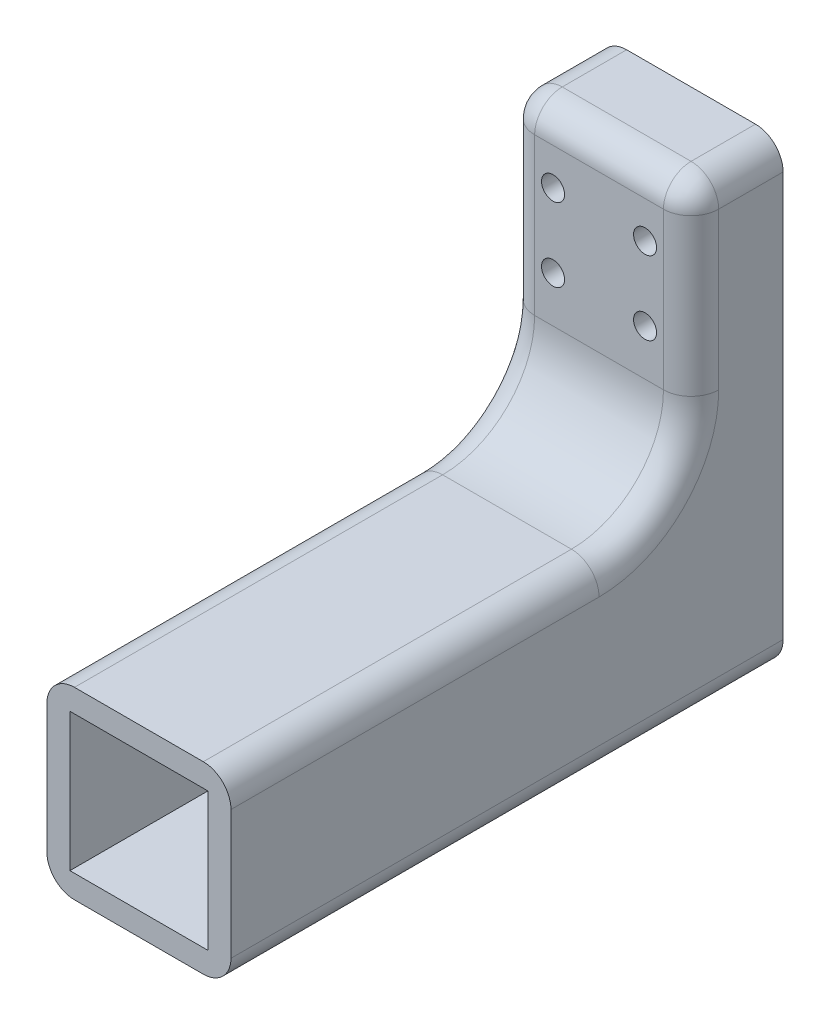
from build123d import *

# Parameters (mm, degrees)
SKETCH_4_W      = 20
SKETCH_4_H      = 20
SKETCH_4_W_2    = 15
SKETCH_4_H_2    = 15
EXTRUDE_3_DEPTH = 60
SKETCH_5_W      = 20
SKETCH_5_H      = 30
EXTRUDE_4_DEPTH = 10
M3X0_5_1_D      = 2.5
FILLET_1_R      = 10
FILLET_2_R      = 3
FILLET_3_R      = 3


with BuildPart() as part:
    # ｽｹｯﾁ4 → ﾎﾞｽ - 押し出し3 (new body)
    with BuildSketch(Plane.XY):
        Rectangle(SKETCH_4_W, SKETCH_4_H)
        Rectangle(SKETCH_4_W_2, SKETCH_4_H_2, mode=Mode.SUBTRACT)
    extrude(amount=EXTRUDE_3_DEPTH)

    # ｽｹｯﾁ5 → ﾎﾞｽ - 押し出し4 (add)
    with BuildSketch(Plane.XY):
        with Locations((0, 25)):
            Rectangle(SKETCH_5_W, SKETCH_5_H)
    extrude(amount=EXTRUDE_4_DEPTH)

    # M3x0.5 ねじ穴1 (through all)
    with Locations(Plane(origin=(0, 0, 0), x_dir=(-1, 0, 0), z_dir=(0, 0, -1))):
        with Locations((-5, 25), (-5, 33), (5, 33), (5, 25)):
            Hole(M3X0_5_1_D / 2)

    # ﾌｨﾚｯﾄ1
    fillet_1_edges = [part.edges().sort_by_distance(p)[0] for p in [
        (0, 10, 10),
    ]]
    fillet(fillet_1_edges, radius=FILLET_1_R)

    # ﾌｨﾚｯﾄ2
    fillet_2_edges = [part.edges().sort_by_distance(p)[0] for p in [
        (10, 40, 5),
        (-10, 40, 5),
        (0, 40, 10),
        (-10, 30, 10),
        (10, 30, 10),
        (10, 12.928932188, 12.928932188),
        (-10, 12.928932188, 12.928932188),
        (-10, 10, 40),
        (10, 10, 40),
    ]]
    fillet(fillet_2_edges, radius=FILLET_2_R)

    # ﾌｨﾚｯﾄ3
    fillet_3_edges = [part.edges().sort_by_distance(p)[0] for p in [
        (10, -10, 30),
        (-10, -10, 30),
    ]]
    fillet(fillet_3_edges, radius=FILLET_3_R)


solid = part.part
